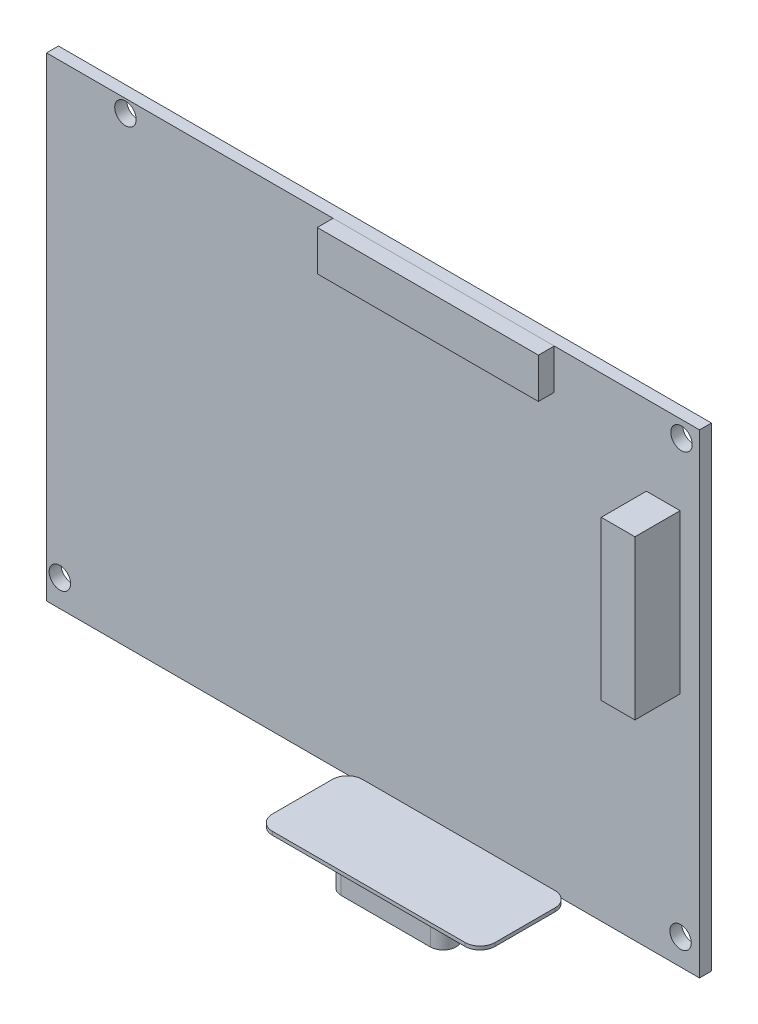
from build123d import *

# Parameters (mm, degrees)
SKETCH1_W           = 90.5256
SKETCH1_H           = 65.8114
SKETCH1_R           = 1.4859
BOSS_EXTRUDE1_DEPTH = 1.651
BOSS_EXTRUDE2_DEPTH = 0.4826
BOSS_EXTRUDE3_DEPTH = 4.826
SKETCH4_W           = 30.6578
SKETCH4_H           = 5.5626
BOSS_EXTRUDE4_DEPTH = 2.1971
SKETCH5_W           = 4.6736
SKETCH5_H           = 21.9964
BOSS_EXTRUDE5_DEPTH = 6.2611


with BuildPart() as part:
    # Sketch1 → Boss-Extrude1 (new body)
    with BuildSketch(Plane.XY):
        Rectangle(SKETCH1_W, SKETCH1_H)
        with Locations((-34.3281, 31.115)):
            Circle(SKETCH1_R, mode=Mode.SUBTRACT)
        with Locations((-43.4213, -29.1846)):
            Circle(SKETCH1_R, mode=Mode.SUBTRACT)
        with Locations((42.7609, 30.6324)):
            Circle(SKETCH1_R, mode=Mode.SUBTRACT)
        with Locations((42.6339, -29.2862)):
            Circle(SKETCH1_R, mode=Mode.SUBTRACT)
    extrude(amount=-BOSS_EXTRUDE1_DEPTH)


with BuildPart() as body_2:
    # Sketch2 → Boss-Extrude2 (new body)
    with BuildSketch(Plane.XZ.offset(32.9057)):
        with BuildLine():
            Line((-1.4732, 0), (25.2222, 0))
            ThreePointArc((25.2222, 0), (26.694962004, 0.610037996), (27.305, 2.0828))
            Line((27.305, 2.0828), (27.305, 10.3886))
            ThreePointArc((27.305, 10.3886), (26.694962004, 11.861362004), (25.2222, 12.4714))
            Line((25.2222, 12.4714), (-1.4732, 12.4714))
            ThreePointArc((-1.4732, 12.4714), (-2.945962004, 11.861362004), (-3.556, 10.3886))
            Line((-3.556, 10.3886), (-3.556, 2.0828))
            ThreePointArc((-3.556, 2.0828), (-2.945962004, 0.610037996), (-1.4732, 0))
        make_face()
    extrude(amount=-BOSS_EXTRUDE2_DEPTH)

    # Sketch3 → Boss-Extrude3 (add)
    with BuildSketch(Plane.XZ.offset(32.9057)):
        with BuildLine():
            Line((5.694889781, 10.1092), (18.054110219, 10.1092))
            ThreePointArc((18.054110219, 10.1092), (19.461868753, 9.41724784), (19.7739, 7.879971554))
            Line((19.7739, 7.879971554), (18.674289781, 3.688971554))
            ThreePointArc((18.674289781, 3.688971554), (18.04054784, 2.732441466), (16.9545, 2.3622))
            Line((16.9545, 2.3622), (6.7945, 2.3622))
            ThreePointArc((6.7945, 2.3622), (5.70845216, 2.732441466), (5.074710219, 3.688971554))
            Line((5.074710219, 3.688971554), (3.9751, 7.879971554))
            ThreePointArc((3.9751, 7.879971554), (4.287131247, 9.41724784), (5.694889781, 10.1092))
        make_face()
    extrude(amount=BOSS_EXTRUDE3_DEPTH)


with BuildPart() as body_3:
    # Sketch4 → Boss-Extrude4 (new body)
    with BuildSketch(Plane.XY):
        with Locations((9.7917, 30.1244)):
            Rectangle(SKETCH4_W, SKETCH4_H)
    extrude(amount=BOSS_EXTRUDE4_DEPTH)


with BuildPart() as body_4:
    # Sketch5 → Boss-Extrude5 (new body)
    with BuildSketch(Plane.XY):
        with Locations((40.2336, 10.8585)):
            Rectangle(SKETCH5_W, SKETCH5_H)
    extrude(amount=BOSS_EXTRUDE5_DEPTH)


solid = Compound([part.part, body_2.part, body_3.part, body_4.part])
